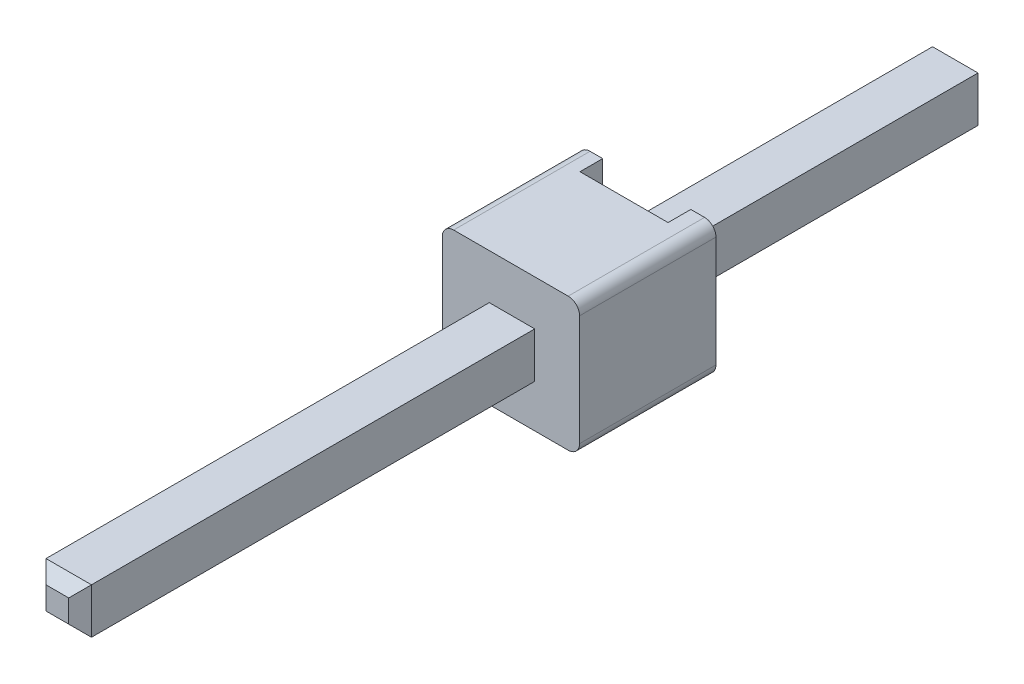
from build123d import *

# Parameters (mm, degrees)
SKETCH1_W                = 1.174125683
SKETCH1_H                = 1.207575088
BOSS_EXTRUDE1_DEPTH      = 1.2
FILLET8_R                = 0.1
SKETCH2_W                = 0.775
SKETCH2_H                = 0.2
CUT_EXTRUDE2_DEPTH       = 1.2
BOSS_EXTRUDE8_DEPTH      = 4
BOSS_EXTRUDE8_DEPTH_BACK = 4
SKETCH7_W                = 0.4
SKETCH7_H                = 0.4
CHAMFER1_SIZE            = 0.1
CHAMFER2_SIZE            = 0.1
BODY_MOVE_COPY3_ANGLE    = 120


with BuildPart() as part:
    # Sketch1 → Boss-Extrude1 (new body)
    with BuildSketch(Plane(origin=(0, 0, 0.178765275), x_dir=(1, 0, 0), z_dir=(0, 1, 0))):
        with Locations((-0.587062841, -0.603787544)):
            Rectangle(SKETCH1_W, SKETCH1_H)
    extrude(amount=BOSS_EXTRUDE1_DEPTH)

    # Fillet8
    fillet8_edges = [part.edges().sort_by_distance(p)[0] for p in [
        (0, 0.6, 1.386340362),
        (-1.174125683, 0.6, 1.386340362),
        (-1.174125683, 0.6, 0.178765275),
        (0, 0.6, 0.178765275),
    ]]
    fillet(fillet8_edges, radius=FILLET8_R)

    # Sketch2 → Cut-Extrude2 (cut)
    with BuildSketch(Plane(origin=(0, 0, 0), x_dir=(0, 0, -1), z_dir=(1, 0, 0))):
        with Locations((-0.7875, 0.1)):
            Rectangle(SKETCH2_W, SKETCH2_H)
    extrude(amount=-CUT_EXTRUDE2_DEPTH, mode=Mode.SUBTRACT)


with BuildPart() as body_2:
    # Sketch7 → Boss-Extrude8 (new, two sides: drawn at the far end of the back side and taken through both)
    with BuildSketch(Plane(origin=(0, 1.2, 0), x_dir=(1, 0, 0), z_dir=(0, 1, 0)).offset(-BOSS_EXTRUDE8_DEPTH_BACK)):
        with Locations((-0.56024756, -0.773060748)):
            Rectangle(SKETCH7_W, SKETCH7_H)
    extrude(amount=BOSS_EXTRUDE8_DEPTH + BOSS_EXTRUDE8_DEPTH_BACK)

    # Chamfer1
    chamfer1_edges = [body_2.edges().sort_by_distance(p)[0] for p in [
        (-0.76024756, 5.2, 0.773060748),
        (-0.56024756, 5.2, 0.973060748),
        (-0.36024756, 5.2, 0.773060748),
        (-0.56024756, 5.2, 0.573060748),
    ]]
    chamfer(chamfer1_edges, length=CHAMFER1_SIZE)

    # Chamfer2
    chamfer2_edges = [body_2.edges().sort_by_distance(p)[0] for p in [
        (-0.36024756, -2.8, 0.773060748),
        (-0.56024756, -2.8, 0.573060748),
        (-0.76024756, -2.8, 0.773060748),
        (-0.56024756, -2.8, 0.973060748),
    ]]
    chamfer(chamfer2_edges, length=CHAMFER2_SIZE)


with BuildPart() as body_2_1:
    # Body-Move/Copy3: moved
    add(body_2.part.moved(Location((0, 0, 0))).rotate(Axis((0.176832127, 0.149512672, 0.027319455), (0.5773502691901439, -0.5773502691895168, -0.5773502691892166)), BODY_MOVE_COPY3_ANGLE))


with BuildPart() as part_1:
    # Body-Move/Copy3: moved
    add(part.part.moved(Location((0, 0, 0))).rotate(Axis((0.176832127, 0.149512672, 0.027319455), (0.5773502691901439, -0.5773502691895168, -0.5773502691892166)), BODY_MOVE_COPY3_ANGLE))


with BuildPart() as body_2_2:
    # Body-Move/Copy4: moved
    add(body_2_1.part.moved(Location((0, 0.017319625, 0))))


solid = Compound([part_1.part, body_2_2.part])
